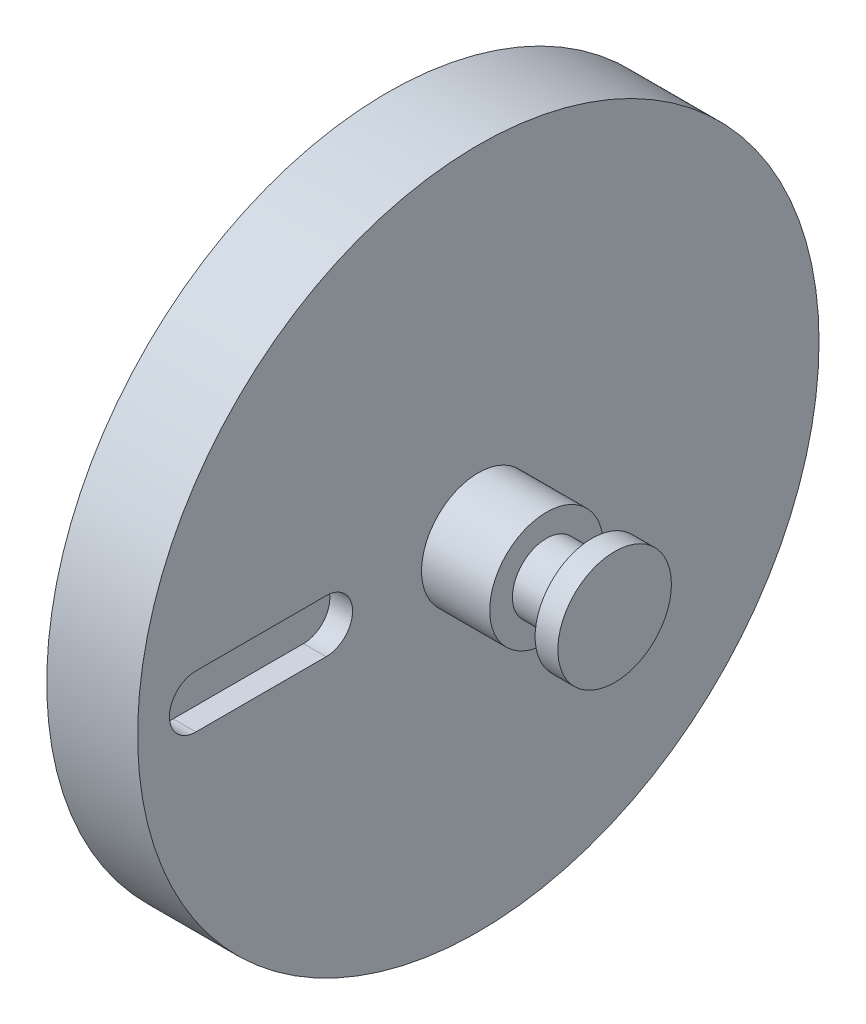
from build123d import *

# Parameters (mm, degrees)
SKETCH_1_R          = 75
EXTRUDE_1_DEPTH     = 10
SKETCH_2_R          = 12.5
EXTRUDE_2_DEPTH     = 30
SKETCH_3_W          = 10
SKETCH_3_H          = 5
CUT_EXTRUDE_1_DEPTH = 5


with BuildPart() as part:
    # 草图1 → 凸台-拉伸1 (new body)
    with BuildSketch(Plane(origin=(0, 0, 0), x_dir=(0, 0, -1), z_dir=(1, 0, 0))):
        Circle(SKETCH_1_R)
    extrude_1 = extrude(amount=EXTRUDE_1_DEPTH)

    # 草图2 → 凸台-拉伸2 (add)
    with BuildSketch(Plane(origin=(10, 0, 0), x_dir=(0, 0, -1), z_dir=(1, 0, 0))):
        Circle(SKETCH_2_R)
    extrude_2 = extrude(amount=EXTRUDE_2_DEPTH)

    # 镜向1: 凸台-拉伸1, 凸台-拉伸2 across plane
    add(extrude_1.mirror(Plane(origin=(0, 0, 0), x_dir=(0, 0, 1), z_dir=(1, 0, 0))))
    add(extrude_2.mirror(Plane(origin=(0, 0, 0), x_dir=(0, 0, 1), z_dir=(1, 0, 0))))

    # 切除-扫描1: sweep along a curve in space
    with BuildLine() as sweep_1_path:
        ThreePointArc((-40, 0, -12.5), (-40, 8.838834765, -8.838834765), (-40, 12.5, 0))
        ThreePointArc((-40, 12.5, 0), (-40, 8.838834765, 8.838834765), (-40, 0, 12.5))
        ThreePointArc((-40, 0, 12.5), (-40, -8.838834765, 8.838834765), (-40, -12.5, 0))
        ThreePointArc((-40, -12.5, 0), (-40, -8.838834765, -8.838834765), (-40, 0, -12.5))
    # 草图3 → 切除-扫描1 (sweep, cut)
    with BuildSketch(Plane(origin=(0, 0, 0), x_dir=(1, 0, 0), z_dir=(0, 1, 0))):
        with Locations((-30, 10)):
            Rectangle(SKETCH_3_W, SKETCH_3_H)
    sweep_1 = sweep(path=sweep_1_path.line, mode=Mode.SUBTRACT)

    # 镜向2: 切除-扫描1 across plane
    add(sweep_1.mirror(Plane(origin=(0, 0, 0), x_dir=(0, 0, 1), z_dir=(1, 0, 0))), mode=Mode.SUBTRACT)

    # 草图5 → 切除-拉伸1 (cut)
    with BuildSketch(Plane.ZY.offset(10)):
        with BuildLine():
            Line((62.177784285, -5.817003296), (33.496104549, -5.817003296))
            ThreePointArc((33.496104549, -5.817003296), (27.679101253, 0), (33.496104549, 5.817003296))
            Line((33.496104549, 5.817003296), (62.177784285, 5.817003296))
            ThreePointArc((62.177784285, 5.817003296), (67.994787582, 0), (62.177784285, -5.817003296))
        make_face()
    cut_extrude_1 = extrude(amount=-CUT_EXTRUDE_1_DEPTH, mode=Mode.SUBTRACT)

    # 镜向3: 切除-拉伸1 across plane
    add(cut_extrude_1.mirror(Plane(origin=(0, 0, 0), x_dir=(0, 0, 1), z_dir=(1, 0, 0))), mode=Mode.SUBTRACT)


solid = part.part
